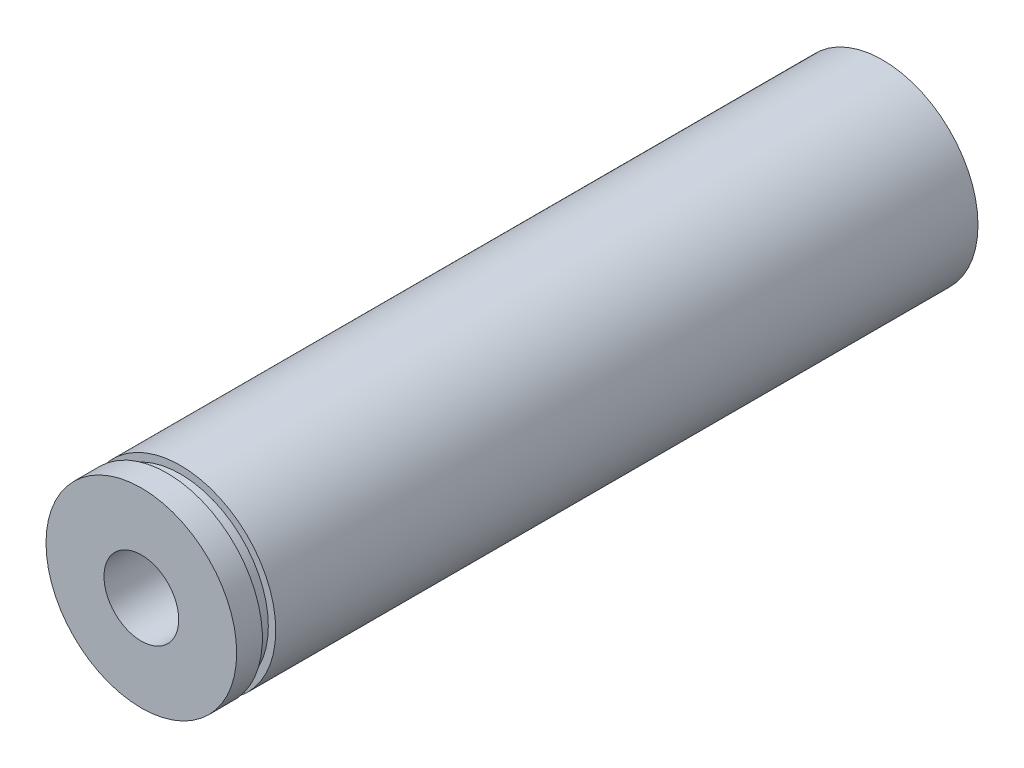
from build123d import *

# Parameters (mm, degrees)
SKETCH1_R           = 6.35
SKETCH1_R_2         = 2.4892
BOSS_EXTRUDE1_DEPTH = 24.6888
SKETCH2_W           = 0.889
SKETCH2_H           = 1.0033


with BuildPart() as part:
    # Sketch1 → Boss-Extrude1 (new, symmetric)
    with BuildSketch(Plane.XY):
        Circle(SKETCH1_R)
        Circle(SKETCH1_R_2, mode=Mode.SUBTRACT)
    extrude(amount=BOSS_EXTRUDE1_DEPTH, both=True)

    # Sketch2 → Cut-Revolve1 (revolve, cut)
    with BuildSketch(Plane(origin=(0, 0, 0), x_dir=(0, 0, -1), z_dir=(1, 0, 0)), mode=Mode.PRIVATE) as cut_revolve1_sk:
        with Locations((-22.5298, 6.35635)):
            Rectangle(SKETCH2_W, SKETCH2_H)
    revolve(cut_revolve1_sk.sketch.rotate(Axis((0, 0, 2.405637885), (0, 0, -1)), 90), axis=Axis((0, 0, 2.405637885), (0, 0, -1)), mode=Mode.SUBTRACT)


solid = part.part
